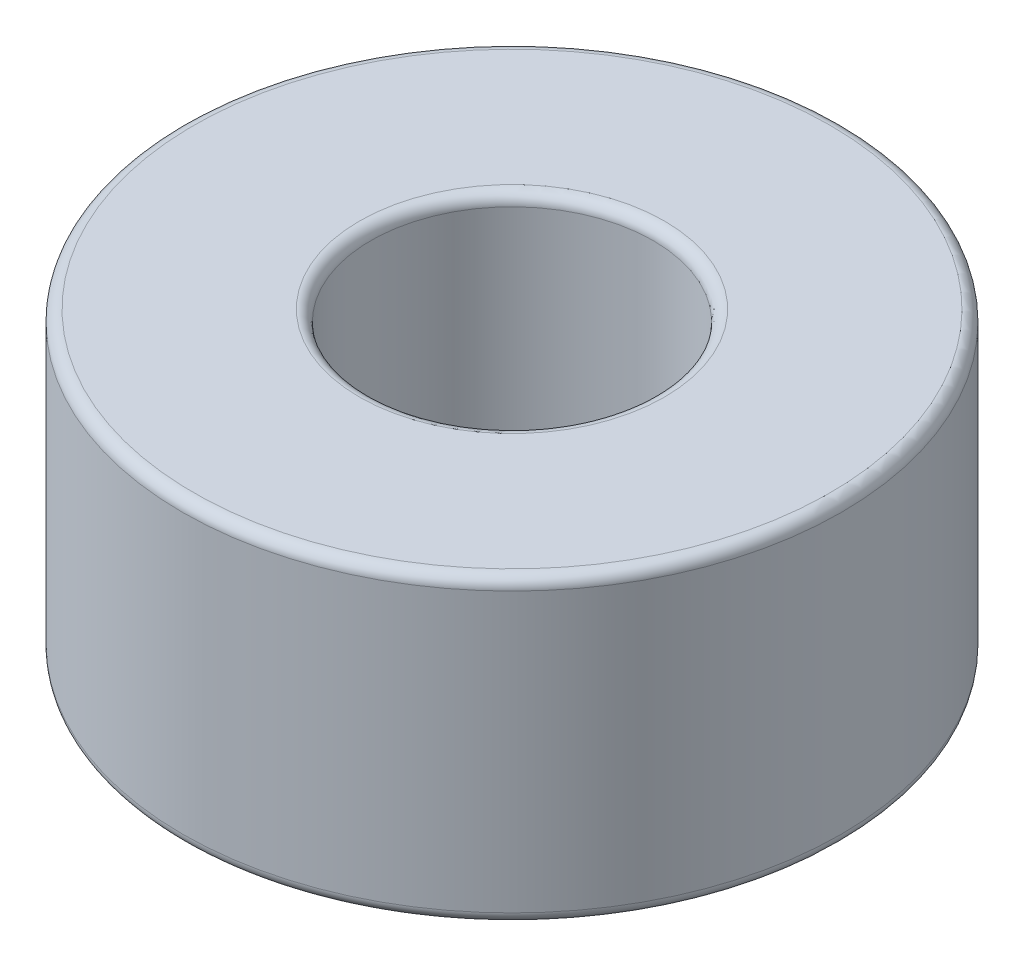
from build123d import *


with BuildPart() as part:
    # Szkic1 → Obrót1 (revolve)
    with BuildSketch(Plane.XY, mode=Mode.PRIVATE) as obr_t1_sk:
        with BuildLine():
            Line((-17.5, 15.4), (-17.5, 0.6))
            ThreePointArc((-17.5, 0.6), (-17.324264069, 0.175735931), (-16.9, 0))
            Line((-16.9, 0), (-8.1, 0))
            ThreePointArc((-8.1, 0), (-7.675735931, 0.175735931), (-7.5, 0.6))
            Line((-7.5, 0.6), (-7.5, 15.4))
            ThreePointArc((-7.5, 15.4), (-7.675735931, 15.824264069), (-8.1, 16))
            Line((-8.1, 16), (-16.9, 16))
            ThreePointArc((-16.9, 16), (-17.324264069, 15.824264069), (-17.5, 15.4))
        make_face()
    revolve(obr_t1_sk.sketch.rotate(Axis((0, 0, 0), (0, 1, 0)), 270), axis=Axis((0, 0, 0), (0, 1, 0)))


solid = part.part
